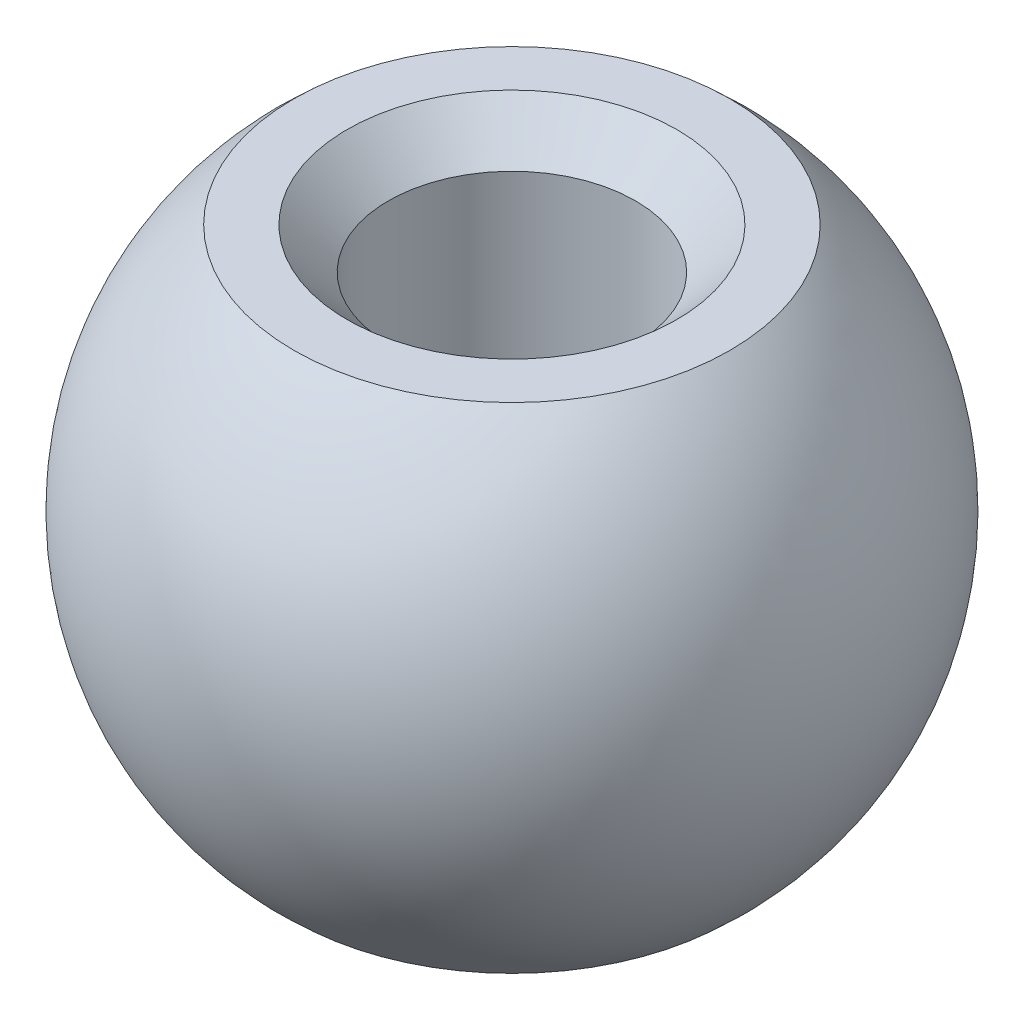
from build123d import *

# Parameters (mm, degrees)
CUT_EXTRUDE_1_DEPTH = 5
SKETCH_4_R          = 1.5
CUT_EXTRUDE_2_DEPTH = 10
CHAMFER_1_SIZE      = 0.5


with BuildPart() as part:
    # 草图1 → 旋转1 (revolve)
    with BuildSketch(Plane.XY):
        with BuildLine():
            Line((0, 4), (0, -4))
            ThreePointArc((0, -4), (4, 0), (0, 4))
        make_face()
    revolve(axis=Axis((0, 4, 0), (0, -1, 0)))

    # 草图3 → 切除-拉伸1 (cut, symmetric)
    with BuildSketch(Plane(origin=(0, 0, 0), x_dir=(0, 0, -1), z_dir=(1, 0, 0))):
        with BuildLine():
            Line((-2.645751311, 3), (2.645751311, 3))
            ThreePointArc((2.645751311, 3), (0, 4), (-2.645751311, 3))
        make_face()
        with BuildLine():
            Line((-2.645751311, -3), (2.645751311, -3))
            ThreePointArc((2.645751311, -3), (0, -4), (-2.645751311, -3))
        make_face()
    extrude(amount=CUT_EXTRUDE_1_DEPTH, both=True, mode=Mode.SUBTRACT)

    # 草图4 → 切除-拉伸2 (cut)
    with BuildSketch(Plane.XZ.offset(3)):
        with Locations(Location((0, 0, 0), (0, 0, 270))):
            Circle(SKETCH_4_R)
    extrude(amount=-CUT_EXTRUDE_2_DEPTH, mode=Mode.SUBTRACT)

    # 倒角1
    chamfer_1_edges = [part.edges().sort_by_distance(p)[0] for p in [
        (0, 3, 1.5),
        (0, -3, 1.5),
    ]]
    chamfer(chamfer_1_edges, length=CHAMFER_1_SIZE)


solid = part.part
